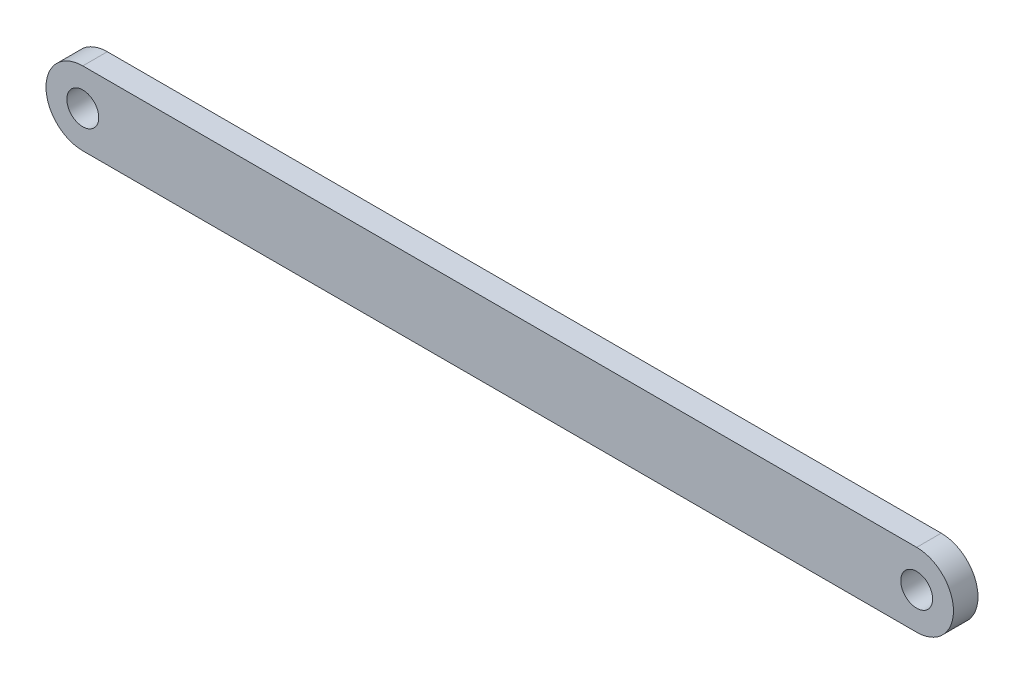
from build123d import *

# Parameters (mm, degrees)
SKETCH1_R           = 3.25
BOSS_EXTRUDE1_DEPTH = 2.5


with BuildPart() as part:
    # Sketch1 → Boss-Extrude1 (new, symmetric)
    with BuildSketch(Plane.XY):
        with BuildLine():
            Line((0, 7.5), (170, 7.5))
            ThreePointArc((170, 7.5), (177.5, 0), (170, -7.5))
            Line((170, -7.5), (0, -7.5))
            ThreePointArc((0, -7.5), (-7.5, 0), (0, 7.5))
        make_face()
        Circle(SKETCH1_R, mode=Mode.SUBTRACT)
        with Locations((170, 0)):
            Circle(SKETCH1_R, mode=Mode.SUBTRACT)
    extrude(amount=BOSS_EXTRUDE1_DEPTH, both=True)


solid = part.part
